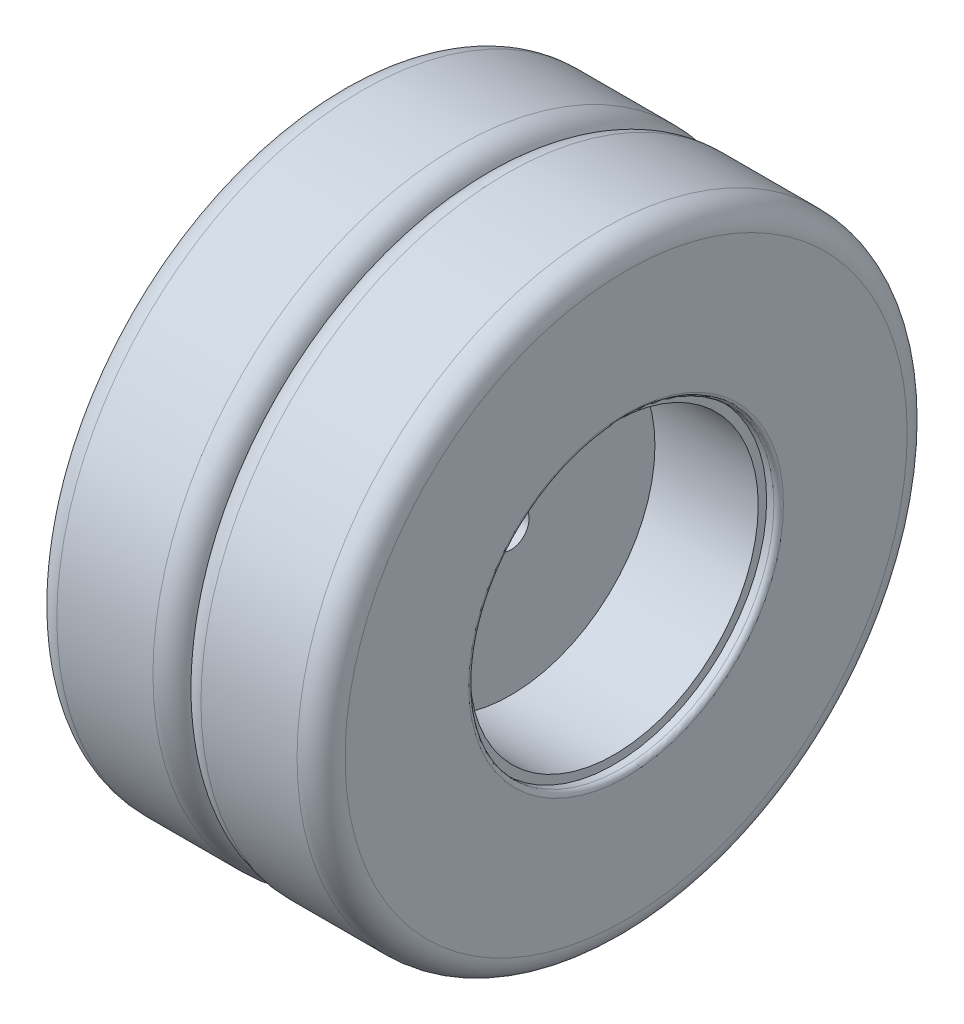
from build123d import *

# Parameters (mm, degrees)
HUB_START      = 5
SKETCH1_R      = 63.5
SKETCH1_R_2    = 7.625
HUB_FACE_DEPTH = 7
SKETCH2_R      = 63.5
SKETCH2_R_2    = 60
HUB_DEPTH      = 50
SKETCH3_R      = 127
SKETCH3_R_2    = 63.5
RUBBER_DEPTH   = 60
FILLET1_R      = 10
FILLET2_R      = 2


with BuildPart() as part:
    # Sketch1 → Hub Face (new body)
    with BuildSketch(Plane(origin=(0, 0, 0), x_dir=(0, 0, -1), z_dir=(1, 0, 0)).offset(HUB_START)):
        Circle(SKETCH1_R)
        Circle(SKETCH1_R_2, mode=Mode.SUBTRACT)
    extrude(amount=HUB_FACE_DEPTH)

    # Sketch2 → Hub (add)
    with BuildSketch(Plane(origin=(0, 0, 0), x_dir=(0, 0, -1), z_dir=(1, 0, 0)).offset(HUB_START)):
        Circle(SKETCH2_R)
        Circle(SKETCH2_R_2, mode=Mode.SUBTRACT)
    extrude(amount=HUB_DEPTH)

    # Sketch3 → Rubber (add)
    with BuildSketch(Plane(origin=(0, 0, 0), x_dir=(0, 0, -1), z_dir=(1, 0, 0))):
        Circle(SKETCH3_R)
        Circle(SKETCH3_R_2, mode=Mode.SUBTRACT)
    extrude(amount=RUBBER_DEPTH)

    # Fillet1
    fillet1_edges = [part.edges().sort_by_distance(p)[0] for p in [
        (60, 0, 127),
        (0, 0, 127),
    ]]
    fillet(fillet1_edges, radius=FILLET1_R)

    # Fillet2
    fillet2_edges = [part.edges().sort_by_distance(p)[0] for p in [
        (0, 0, 63.5),
        (60, 0, 63.5),
    ]]
    fillet(fillet2_edges, radius=FILLET2_R)


with BuildPart() as body_2:
    # Mirror1: mirrored copy
    add(part.part.mirror(Plane(origin=(0, 0, 0), x_dir=(0, 0, 1), z_dir=(1, 0, 0))))


solid = Compound([part.part, body_2.part])
